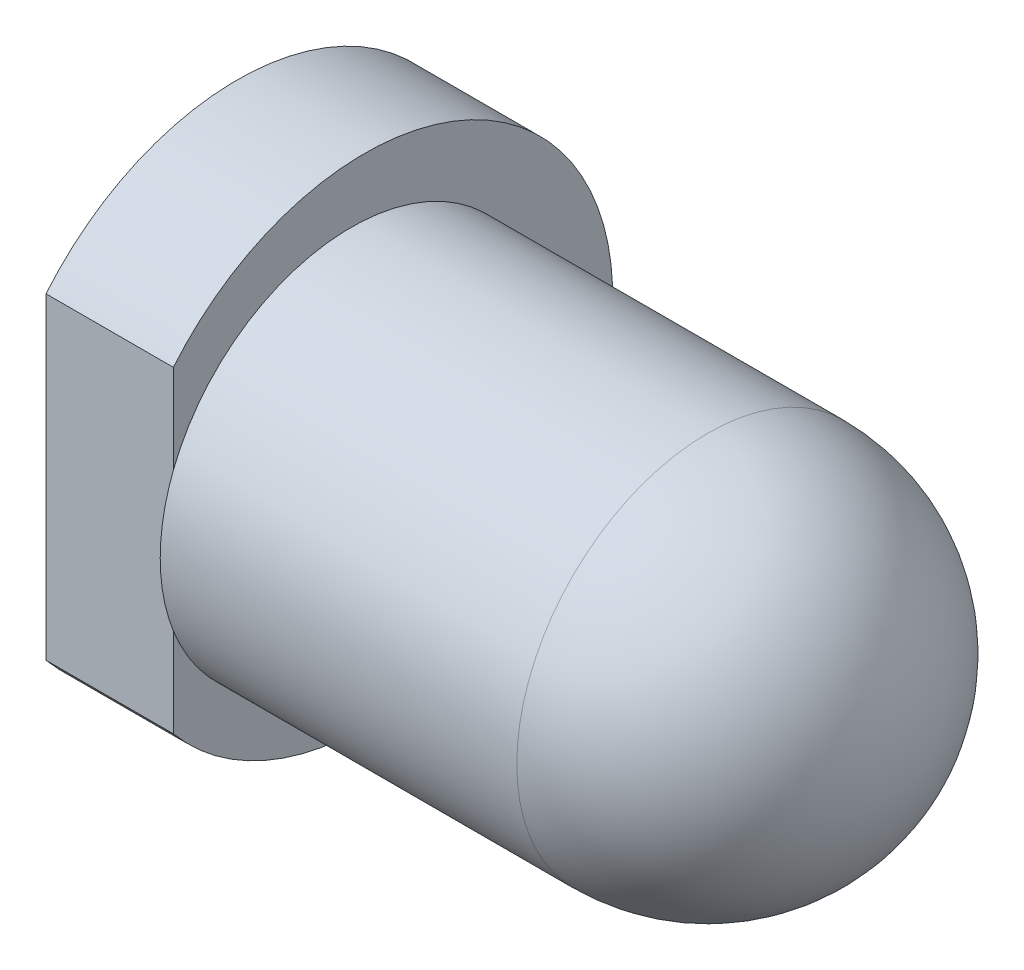
from build123d import *

# Parameters (mm, degrees)
SKETCH_1_R          = 1.95
EXTRUDE_1_DEPTH     = 1
SKETCH_2_R          = 1.5
EXTRUDE_2_DEPTH     = 4.3
FILLET_1_R          = 1.5
CUT_EXTRUDE_1_DEPTH = 0.45


with BuildPart() as part:
    # Эскиз1 → Бобышка-Вытянуть1 (new body)
    with BuildSketch(Plane(origin=(0, 0, 0), x_dir=(0, 0, -1), z_dir=(1, 0, 0))):
        Circle(SKETCH_1_R)
    extrude(amount=EXTRUDE_1_DEPTH)

    # Эскиз2 → Бобышка-Вытянуть2 (add)
    with BuildSketch(Plane(origin=(1, 0, 0), x_dir=(0, 0, -1), z_dir=(1, 0, 0))):
        with Locations(Location((-0.103125187, 0, 0), (0, 0, 180))):
            Circle(SKETCH_2_R)
    extrude(amount=EXTRUDE_2_DEPTH)

    # Скругление1
    fillet_1_edges = [part.edges().sort_by_distance(p)[0] for p in [
        (5.3, 0, -1.396874813),
    ]]
    fillet(fillet_1_edges, radius=FILLET_1_R)

    # Эскиз4 → Вырез-Вытянуть1 (cut)
    with BuildSketch(Plane.XY.offset(1.95)):
        Polygon((0, 0), (0, 2.822887507), (1, 2.822887507), (1, 0), (1, -3.256991154), (0, -3.256991154), align=None)
    extrude(amount=-CUT_EXTRUDE_1_DEPTH, mode=Mode.SUBTRACT)


solid = part.part
